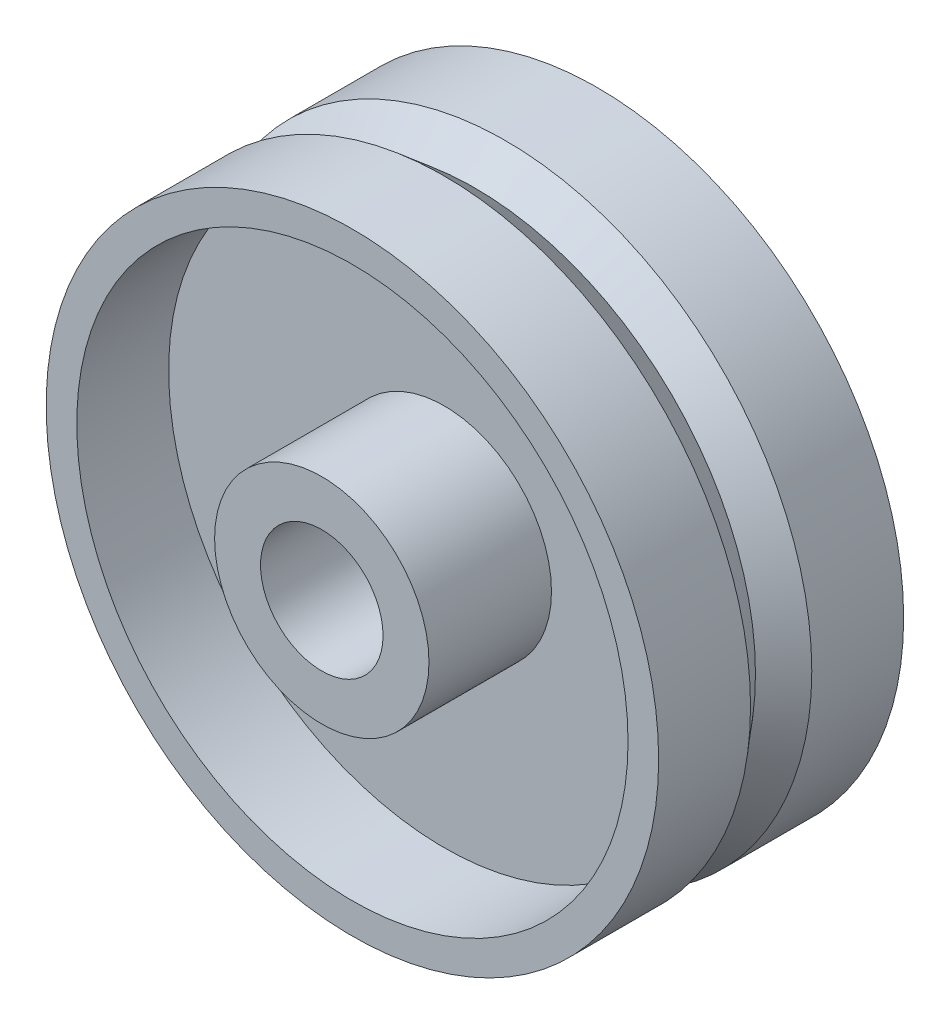
from build123d import *


with BuildPart() as part:
    # Croquis1 → Revolución3 (revolve)
    with BuildSketch(Plane(origin=(0, 0, 0), x_dir=(0, 0, -1), z_dir=(1, 0, 0)), mode=Mode.PRIVATE) as revoluci_n3_sk:
        Polygon((25, 10), (-25, 10), (-25, 17.5), (-5, 17.5), (-5, 45), (-20, 45), (-20, 50), (-5, 50), (0, 45.804501844), (5, 50), (20, 50), (20, 45), (5, 45), (5, 17.5), (25, 17.5), align=None)
    revolve(revoluci_n3_sk.sketch.rotate(Axis((0, 0, 0), (0, 0, -1)), 90), axis=Axis((0, 0, 0), (0, 0, -1)))


solid = part.part
